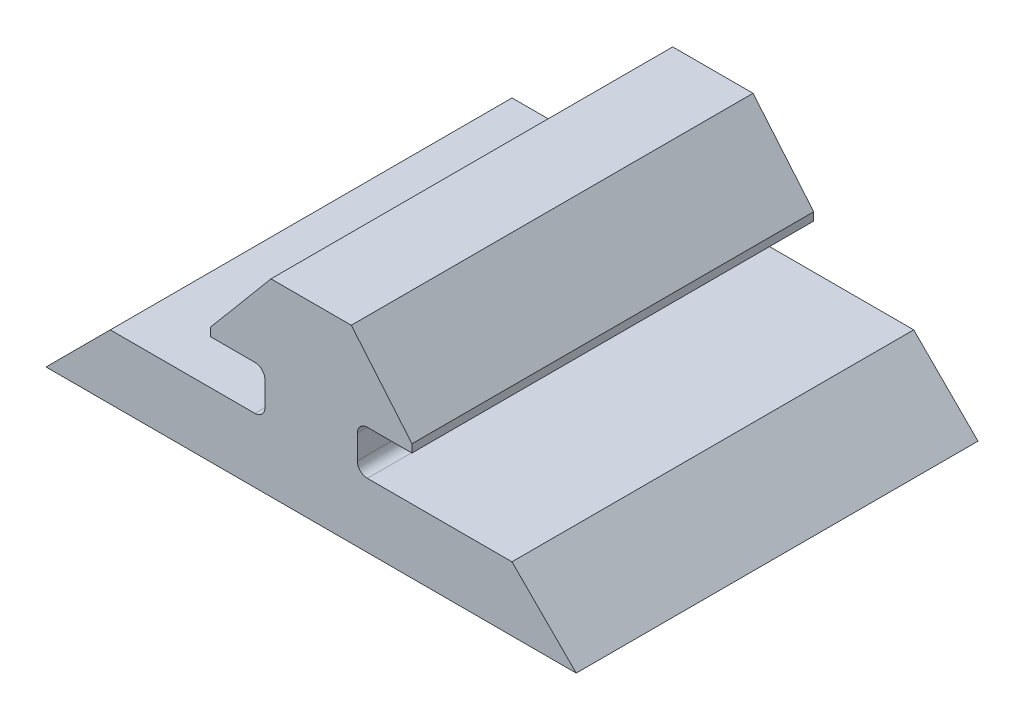
from build123d import *

# Parameters (mm, degrees)
BOSS_EXTRUDE1_DEPTH     = 3683
SKETCH2_W               = 25.4
SKETCH2_H               = 4.064
BOSS_EXTRUDE2_DEPTH     = 50.8
SKETCH3_W               = 25.4
SKETCH3_H               = 3632.2
CUT_EXTRUDE1_DEPTH      = 50.8
SKETCH4_W               = 12.752727098
SKETCH4_H               = 3632.2
CUT_EXTRUDE2_DEPTH      = 50.8
SKETCH5_W               = 25.4
SKETCH5_H               = 4.064
BOSS_EXTRUDE3_DEPTH     = 50.8
SKETCH6_W               = 25.4
SKETCH6_H               = 4.064
CUT_EXTRUDE3_DEPTH      = 65.612427938
SKETCH7_W               = 25.4
SKETCH7_H               = 4.064
CUT_EXTRUDE4_DEPTH      = 65.612427938
BOSS_EXTRUDE4_DEPTH     = 50.8
BOSS_EXTRUDE5_DEPTH     = 50.8
CUT_EXTRUDE5_DEPTH      = 55.810469255
CUT_EXTRUDE5_DEPTH_BACK = 55.810469255
SKETCH10_W              = 33.528
SKETCH10_H              = 25.3968625


with BuildPart() as part:
    # Sketch1 → Boss-Extrude1 (new body)
    with BuildSketch(Plane(origin=(0, 0, -3683), x_dir=(-1, 0, 0), z_dir=(0, 0, -1))):
        with BuildLine():
            Line((12.7, 4.064), (3.556, 4.064))
            ThreePointArc((3.556, 4.064), (3.106987194, 4.249987194), (2.921, 4.699))
            Line((2.921, 4.699), (2.921, 6.223))
            ThreePointArc((2.921, 6.223), (3.106987194, 6.672012806), (3.556, 6.858))
            Line((3.556, 6.858), (6.376363549, 6.858))
            Line((6.376363549, 6.858), (6.376363549, 7.365999958))
            Line((6.376363549, 7.365999958), (2.54, 11.938))
            Line((2.54, 11.938), (-2.54, 11.938))
            Line((-2.54, 11.938), (-6.376363549, 7.365999958))
            Line((-6.376363549, 7.365999958), (-6.376363549, 6.858))
            Line((-6.376363549, 6.858), (-3.556, 6.858))
            ThreePointArc((-3.556, 6.858), (-3.106987194, 6.672012806), (-2.921, 6.223))
            Line((-2.921, 6.223), (-2.921, 4.699))
            ThreePointArc((-2.921, 4.699), (-3.106987194, 4.249987194), (-3.556, 4.064))
            Line((-3.556, 4.064), (-12.7, 4.064))
            Line((-12.7, 4.064), (-12.7, 0))
            Line((-12.7, 0), (12.7, 0))
            Line((12.7, 0), (12.7, 4.064))
        make_face()
    extrude(amount=-BOSS_EXTRUDE1_DEPTH)

    # Sketch2 → Boss-Extrude2 (add)
    with BuildSketch(Plane.XY):
        with Locations((25.4, 2.032)):
            Rectangle(SKETCH2_W, SKETCH2_H)
    extrude(amount=-BOSS_EXTRUDE2_DEPTH)

    # Sketch3 → Cut-Extrude1 (cut)
    with BuildSketch(Plane(origin=(0, 4.064, 0), x_dir=(-1, 0, 0), z_dir=(0, 1, 0))):
        with Locations((0, -1866.9)):
            Rectangle(SKETCH3_W, SKETCH3_H)
    extrude(amount=-CUT_EXTRUDE1_DEPTH, mode=Mode.SUBTRACT)

    # Sketch4 → Cut-Extrude2 (cut)
    with BuildSketch(Plane(origin=(0, 11.938, 0), x_dir=(-1, 0, 0), z_dir=(0, 1, 0))):
        with Locations((0, -1866.9)):
            Rectangle(SKETCH4_W, SKETCH4_H)
    extrude(amount=-CUT_EXTRUDE2_DEPTH, mode=Mode.SUBTRACT)

    # Sketch5 → Boss-Extrude3 (add)
    with BuildSketch(Plane.XY):
        with Locations((-25.4, 2.032)):
            Rectangle(SKETCH5_W, SKETCH5_H)
    extrude(amount=-BOSS_EXTRUDE3_DEPTH)

    # Sketch6 → Cut-Extrude3 (cut, through all)
    with BuildSketch(Plane.XY):
        with Locations((-25.4, 2.032)):
            Rectangle(SKETCH6_W, SKETCH6_H)
    extrude(amount=-CUT_EXTRUDE3_DEPTH, mode=Mode.SUBTRACT)

    # Sketch7 → Cut-Extrude4 (cut, through all)
    with BuildSketch(Plane.XY):
        with Locations((25.4, 2.032)):
            Rectangle(SKETCH7_W, SKETCH7_H)
    extrude(amount=-CUT_EXTRUDE4_DEPTH, mode=Mode.SUBTRACT)

    # Sketch8 → Boss-Extrude4 (add, through all)
    with BuildSketch(Plane.XY):
        Polygon((12.7, 4.064), (16.764, 0), (12.7, 0), align=None)
    extrude(amount=-BOSS_EXTRUDE4_DEPTH)

    # Sketch9 → Boss-Extrude5 (add, through all)
    with BuildSketch(Plane.XY):
        Polygon((-12.7, 4.064), (-16.764, 0), (-12.7, 0), align=None)
    extrude(amount=-BOSS_EXTRUDE5_DEPTH)

    # Sketch10 → Cut-Extrude5 (cut, two sides: drawn at the far end of the back side and taken through both)
    with BuildSketch(Plane.XZ.offset(-CUT_EXTRUDE5_DEPTH_BACK)):
        with Locations((0, -38.10159375)):
            Rectangle(SKETCH10_W, SKETCH10_H)
    extrude(amount=CUT_EXTRUDE5_DEPTH + CUT_EXTRUDE5_DEPTH_BACK, mode=Mode.SUBTRACT)


solid = part.part
